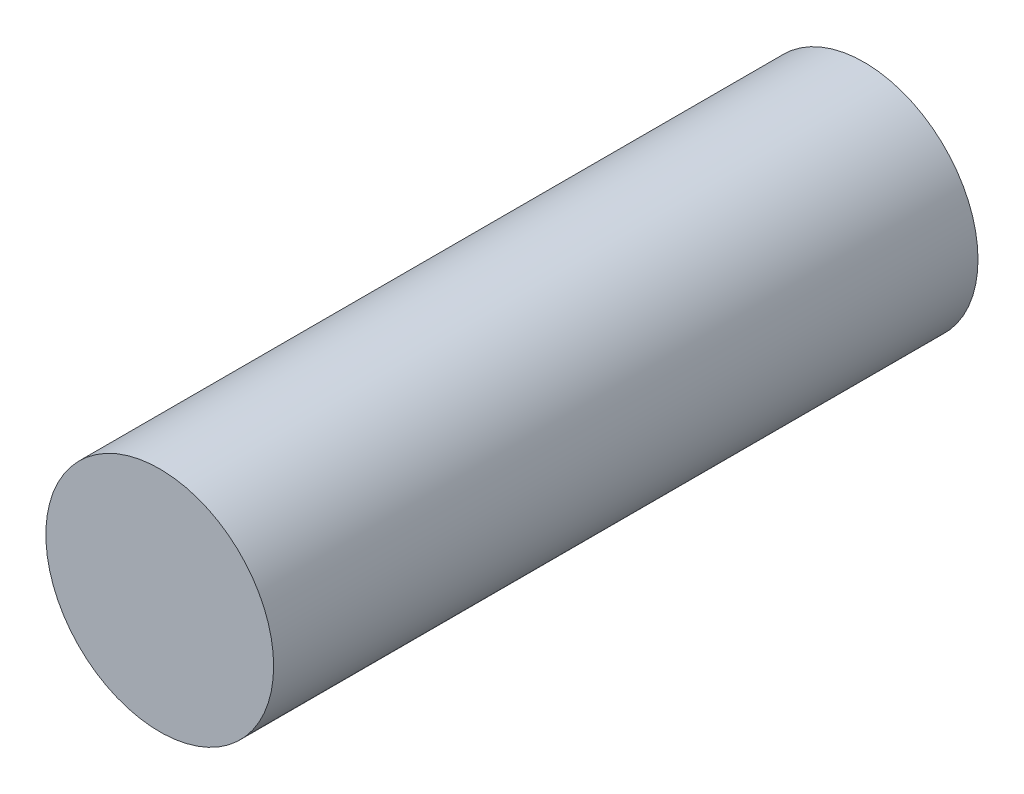
from build123d import *

# Parameters (mm, degrees)
SKETCH_1_R  = 3.8
CABLE_DEPTH = 23.5


with BuildPart() as part:
    # 草图1 → Cable (new body)
    with BuildSketch(Plane.XY):
        Circle(SKETCH_1_R)
    extrude(amount=CABLE_DEPTH)


solid = part.part
